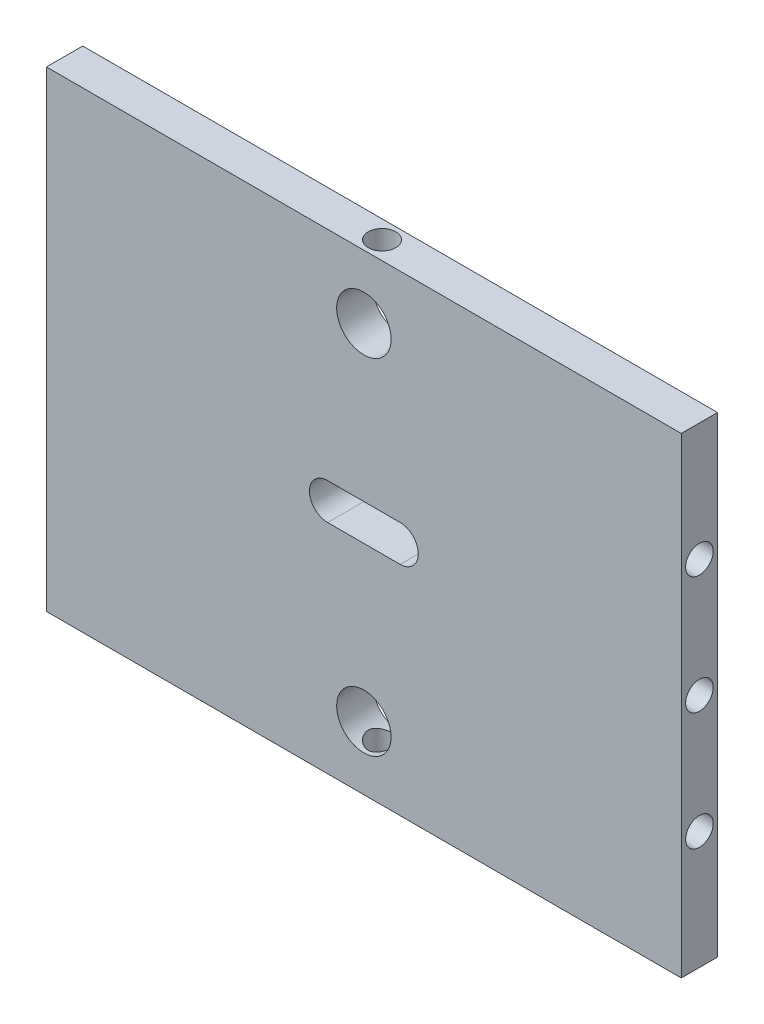
from build123d import *

# Parameters (mm, degrees)
SKETCH1_W           = 111.125
SKETCH1_H           = 82.55
SKETCH1_R           = 4.7625
BOSS_EXTRUDE1_DEPTH = 6.35
SKETCH2_R           = 2.413
CUT_EXTRUDE1_DEPTH  = 12.7
SKETCH3_R           = 2.413
CUT_EXTRUDE2_DEPTH  = 12.7
CUT_EXTRUDE3_DEPTH  = 7.62


with BuildPart() as part:
    # Sketch1 → Boss-Extrude1 (new body)
    with BuildSketch(Plane.XY):
        Rectangle(SKETCH1_W, SKETCH1_H)
        with Locations((0, 30.1625)):
            Circle(SKETCH1_R, mode=Mode.SUBTRACT)
        with Locations(Location((0, -30.1625, 0), (0, 0, 180))):
            Circle(SKETCH1_R, mode=Mode.SUBTRACT)
    extrude(amount=BOSS_EXTRUDE1_DEPTH)

    # Sketch2 → Cut-Extrude1 (cut)
    with BuildSketch(Plane(origin=(55.5625, 0, 0), x_dir=(0, 0, -1), z_dir=(1, 0, 0))):
        with Locations((-3.175, 20.6375)):
            Circle(SKETCH2_R)
        with Locations((-3.175, 0)):
            Circle(SKETCH2_R)
        with Locations((-3.175, -20.6375)):
            Circle(SKETCH2_R)
    cut_extrude1 = extrude(amount=-CUT_EXTRUDE1_DEPTH, mode=Mode.SUBTRACT)

    # Mirror1: Cut-Extrude1 across plane
    add(cut_extrude1.mirror(Plane(origin=(0, 0, 0), x_dir=(0, 0, 1), z_dir=(1, 0, 0))), mode=Mode.SUBTRACT)

    # Sketch3 → Cut-Extrude2 (cut)
    with BuildSketch(Plane(origin=(0, 41.275, 0), x_dir=(1, 0, 0), z_dir=(0, 1, 0))):
        with Locations(Location((0, -3.175, 0), (0, 0, 180))):
            Circle(SKETCH3_R)
    cut_extrude2 = extrude(amount=-CUT_EXTRUDE2_DEPTH, mode=Mode.SUBTRACT)

    # Mirror2: Cut-Extrude2 across plane
    add(cut_extrude2.mirror(Plane.ZX), mode=Mode.SUBTRACT)

    # Sketch4 → Cut-Extrude3 (cut)
    with BuildSketch(Plane.XY.offset(6.35)):
        with BuildLine():
            Line((-6.35, 3.175), (6.35, 3.175))
            ThreePointArc((6.35, 3.175), (9.525, 0), (6.35, -3.175))
            Line((6.35, -3.175), (-6.35, -3.175))
            ThreePointArc((-6.35, -3.175), (-9.525, 0), (-6.35, 3.175))
        make_face()
    extrude(amount=-CUT_EXTRUDE3_DEPTH, mode=Mode.SUBTRACT)


solid = part.part
